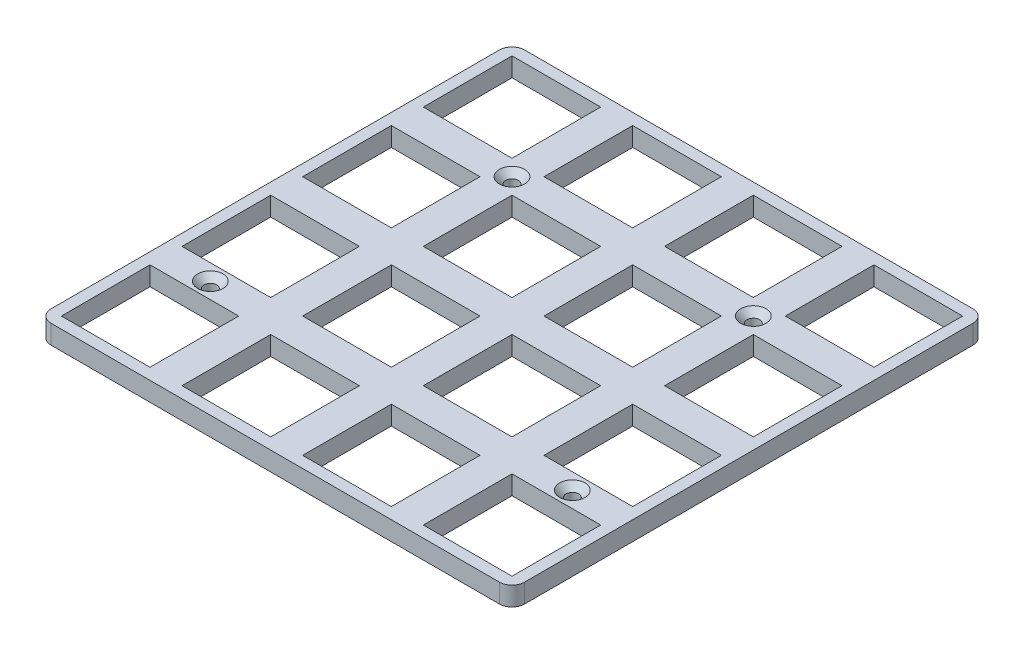
from build123d import *

# Parameters (mm, degrees)
SKETCH1_W                = 75.15
SKETCH1_H                = 75.15
SKETCH1_W_2              = 14
SKETCH1_H_2              = 14
BOSS_EXTRUDE1_DEPTH      = 3
SKETCH2_R                = 1
CUT_EXTRUDE1_DEPTH       = 3
CHAMFER1_SIZE            = 1
CHAMFER1_OF_MIRROR1_SIZE = 1
MOVE_FACE1_BY            = 0.2
MOVE_FACE1_2_BY          = 0.2
MOVE_FACE1_3_BY          = 0.2
MOVE_FACE1_4_BY          = 0.2
FILLET1_R                = 2


with BuildPart() as part:
    # Sketch1 → Boss-Extrude1 (new body)
    with BuildSketch(Plane(origin=(0, 0, 0), x_dir=(1, 0, 0), z_dir=(0, 1, 0))):
        Rectangle(SKETCH1_W, SKETCH1_H)
        with Locations((-9.525, 28.575)):
            Rectangle(SKETCH1_W_2, SKETCH1_H_2, mode=Mode.SUBTRACT)
        with Locations((-28.575, 28.575)):
            Rectangle(SKETCH1_W_2, SKETCH1_H_2, mode=Mode.SUBTRACT)
        with Locations((9.525, 28.575)):
            Rectangle(SKETCH1_W_2, SKETCH1_H_2, mode=Mode.SUBTRACT)
        with Locations((28.575, 28.575)):
            Rectangle(SKETCH1_W_2, SKETCH1_H_2, mode=Mode.SUBTRACT)
        with Locations((-9.525, 9.525)):
            Rectangle(SKETCH1_W_2, SKETCH1_H_2, mode=Mode.SUBTRACT)
        with Locations((9.525, 9.525)):
            Rectangle(SKETCH1_W_2, SKETCH1_H_2, mode=Mode.SUBTRACT)
        with Locations((28.575, 9.525)):
            Rectangle(SKETCH1_W_2, SKETCH1_H_2, mode=Mode.SUBTRACT)
        with Locations((-9.525, -9.525)):
            Rectangle(SKETCH1_W_2, SKETCH1_H_2, mode=Mode.SUBTRACT)
        with Locations((9.525, -9.525)):
            Rectangle(SKETCH1_W_2, SKETCH1_H_2, mode=Mode.SUBTRACT)
        with Locations((28.575, -9.525)):
            Rectangle(SKETCH1_W_2, SKETCH1_H_2, mode=Mode.SUBTRACT)
        with Locations((-9.525, -28.575)):
            Rectangle(SKETCH1_W_2, SKETCH1_H_2, mode=Mode.SUBTRACT)
        with Locations((9.525, -28.575)):
            Rectangle(SKETCH1_W_2, SKETCH1_H_2, mode=Mode.SUBTRACT)
        with Locations((28.575, -28.575)):
            Rectangle(SKETCH1_W_2, SKETCH1_H_2, mode=Mode.SUBTRACT)
        with Locations((-28.575, 9.525)):
            Rectangle(SKETCH1_W_2, SKETCH1_H_2, mode=Mode.SUBTRACT)
        with Locations((-28.575, -9.525)):
            Rectangle(SKETCH1_W_2, SKETCH1_H_2, mode=Mode.SUBTRACT)
        with Locations((-28.575, -28.575)):
            Rectangle(SKETCH1_W_2, SKETCH1_H_2, mode=Mode.SUBTRACT)
    extrude(amount=BOSS_EXTRUDE1_DEPTH)

    # Sketch2 → Cut-Extrude1 (cut)
    with BuildSketch(Plane(origin=(0, 3, 0), x_dir=(1, 0, 0), z_dir=(0, 1, 0))):
        with Locations(Location((-19.05, 19.05, 0), (0, 0, 270))):
            Circle(SKETCH2_R)
        with Locations(Location((-28.575, -19.05, 0), (0, 0, 270))):
            Circle(SKETCH2_R)
    cut_extrude1 = extrude(amount=-CUT_EXTRUDE1_DEPTH, mode=Mode.SUBTRACT)

    # Chamfer1
    chamfer1_edges = [part.edges().sort_by_distance(p)[0] for p in [
        (-19.05, 3, -20.05),
        (-28.575, 3, 18.05),
    ]]
    chamfer(chamfer1_edges, length=CHAMFER1_SIZE)

    # Mirror1: Cut-Extrude1 across plane
    add(cut_extrude1.mirror(Plane(origin=(0, 0, 0), x_dir=(0, 0, 1), z_dir=(1, 0, 0))), mode=Mode.SUBTRACT)

    # Chamfer1 of Mirror1
    chamfer1_of_mirror1_edges = [part.edges().sort_by_distance(p)[0] for p in [
        (19.05, 3, -20.05),
        (28.575, 3, 18.05),
    ]]
    chamfer(chamfer1_of_mirror1_edges, length=CHAMFER1_OF_MIRROR1_SIZE)

    # Move Face1: a face moved inward by 0.2
    extrude(part.faces().sort_by_distance((37.575, 1.5, 0))[0], amount=MOVE_FACE1_BY, dir=(-1, 0, 0), mode=Mode.SUBTRACT)

    # Move Face1 2: a face moved inward by 0.2
    extrude(part.faces().sort_by_distance((0, 1.5, -37.575))[0], amount=MOVE_FACE1_2_BY, dir=(0, 0, 1), mode=Mode.SUBTRACT)

    # Move Face1 3: a face moved inward by 0.2
    extrude(part.faces().sort_by_distance((0, 1.5, 37.575))[0], amount=MOVE_FACE1_3_BY, dir=(0, 0, -1), mode=Mode.SUBTRACT)

    # Move Face1 4: a face moved inward by 0.2
    extrude(part.faces().sort_by_distance((-37.575, 1.5, 0))[0], amount=MOVE_FACE1_4_BY, dir=(1, 0, 0), mode=Mode.SUBTRACT)

    # Fillet1
    fillet1_edges = [part.edges().sort_by_distance(p)[0] for p in [
        (37.375, 1.5, 37.375),
        (-37.375, 1.5, 37.375),
        (-37.375, 1.5, -37.375),
        (37.375, 1.5, -37.375),
    ]]
    fillet(fillet1_edges, radius=FILLET1_R)


solid = part.part
